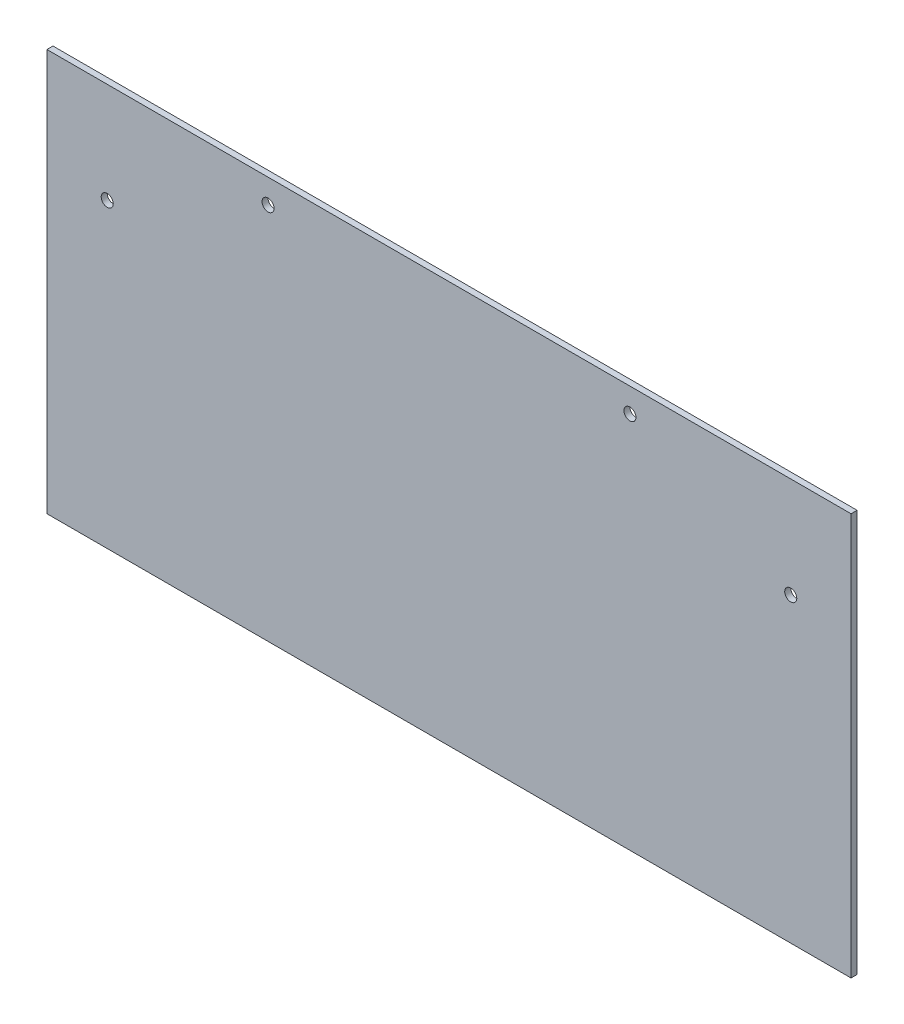
from build123d import *

# Parameters (mm, degrees)
SKETCH1_W             = 200
SKETCH1_H             = 100
BOSS_EXTRUDE1_DEPTH   = 1.5
F_3_0MM_DOWEL_HOLE2_D = 3
F_3_0MM_DOWEL_HOLE3_D = 3


with BuildPart() as part:
    # Sketch1 → Boss-Extrude1 (new body)
    with BuildSketch(Plane.XY):
        with Locations((100, 50)):
            Rectangle(SKETCH1_W, SKETCH1_H)
    extrude(amount=BOSS_EXTRUDE1_DEPTH)

    # Ø3.0mm Dowel Hole2 (through all)
    with Locations(Plane.XY.offset(1.5)):
        with Locations((15, 75), (185, 75)):
            Hole(F_3_0MM_DOWEL_HOLE2_D / 2)

    # Ø3.0mm Dowel Hole3 (through all)
    with Locations(Plane.XY.offset(1.5)):
        with Locations((55, 94), (145, 94)):
            Hole(F_3_0MM_DOWEL_HOLE3_D / 2)


solid = part.part
